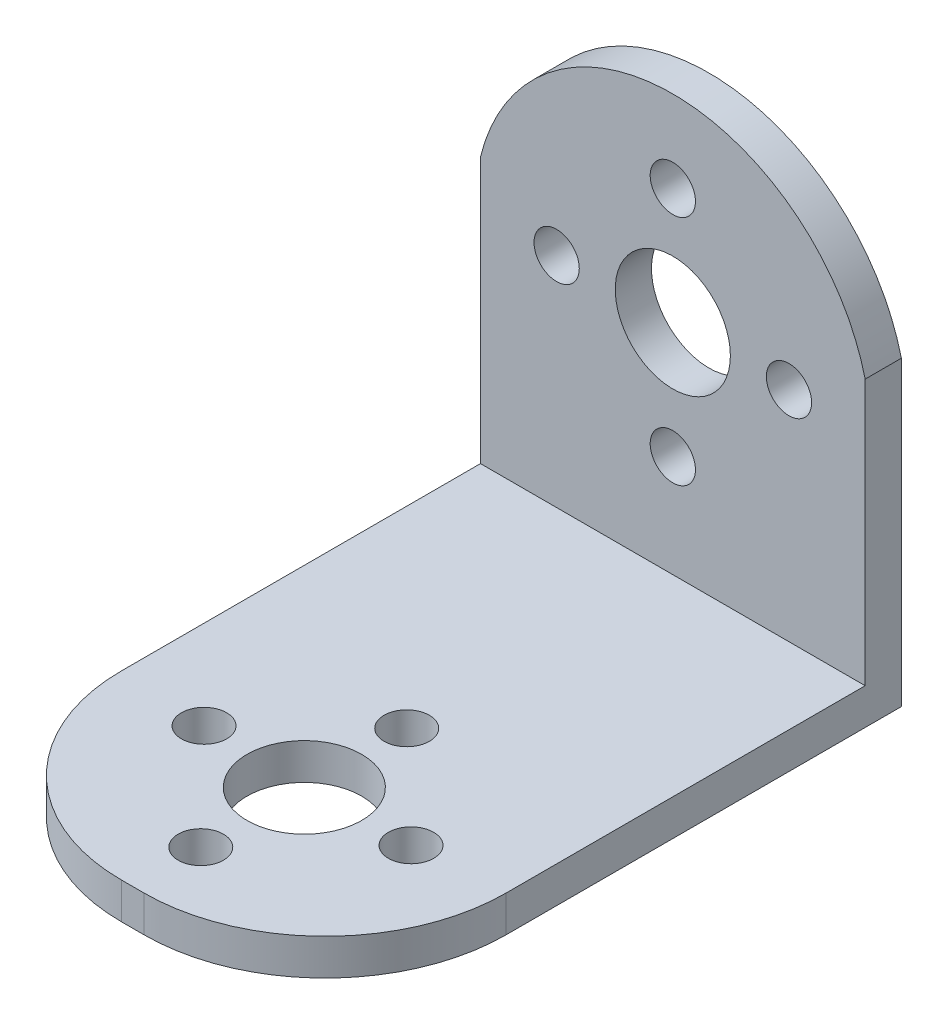
from build123d import *

# Parameters (mm, degrees)
SKETCH1_R           = 1.5
SKETCH1_R_2         = 3.815
BOSS_EXTRUDE1_DEPTH = 2.4
SKETCH2_W           = 25.5
SKETCH2_H           = 2.4
BOSS_EXTRUDE2_DEPTH = 35.8
CUT_EXTRUDE1_DEPTH  = 35.8
SKETCH4_R           = 3.8
SKETCH4_R_2         = 1.500976088
SKETCH4_R_3         = 1.5
CUT_EXTRUDE2_DEPTH  = 35.8


with BuildPart() as part:
    # Sketch1 → Boss-Extrude1 (new body)
    with BuildSketch(Plane.XY):
        with BuildLine():
            Line((0, 0), (25.5, 0))
            Line((25.5, 0), (25.5, 20))
            ThreePointArc((25.5, 20), (12.75, 30), (0, 20))
            Line((0, 20), (0, 0))
        make_face()
        with Locations((12.75, 24.571875)):
            Circle(SKETCH1_R, mode=Mode.SUBTRACT)
        with Locations((12.75, 16.871875)):
            Circle(SKETCH1_R_2, mode=Mode.SUBTRACT)
        with Locations((20.45, 16.871875)):
            Circle(SKETCH1_R, mode=Mode.SUBTRACT)
        with Locations((12.75, 9.171875)):
            Circle(SKETCH1_R, mode=Mode.SUBTRACT)
        with Locations((5.05, 16.871875)):
            Circle(SKETCH1_R, mode=Mode.SUBTRACT)
    extrude(amount=BOSS_EXTRUDE1_DEPTH)

    # Sketch2 → Boss-Extrude2 (add)
    with BuildSketch(Plane.XY.offset(2.4)):
        with Locations((12.75, 1.2)):
            Rectangle(SKETCH2_W, SKETCH2_H)
    extrude(amount=BOSS_EXTRUDE2_DEPTH)

    # Sketch3 → Cut-Extrude1 (cut)
    with BuildSketch(Plane.XZ):
        with BuildLine():
            ThreePointArc((0, 26.2), (3.514718626, 34.685281374), (12, 38.2))
            Line((12, 38.2), (0, 38.2))
            Line((0, 38.2), (0, 26.2))
        make_face()
        with BuildLine():
            Line((25.5, 38.2), (13.5, 38.2))
            ThreePointArc((13.5, 38.2), (21.985281374, 34.685281374), (25.5, 26.2))
            Line((25.5, 26.2), (25.5, 38.2))
        make_face()
    extrude(amount=-CUT_EXTRUDE1_DEPTH, mode=Mode.SUBTRACT)

    # Sketch4 → Cut-Extrude2 (cut)
    with BuildSketch(Plane.XZ):
        with Locations(Location((12.75, 26.823800226, 0), (0, 0, 270))):
            Circle(SKETCH4_R)
        with Locations(Location((5.89, 26.612165956, 0), (0, 0, 270))):
            Circle(SKETCH4_R_2)
        with Locations(Location((19.61, 26.612165956, 0), (0, 0, 270))):
            Circle(SKETCH4_R_3)
        with Locations(Location((12.75, 33.687165956, 0), (0, 0, 270))):
            Circle(SKETCH4_R_3)
        with Locations(Location((12.75, 20.037167493, 0), (0, 0, 270))):
            Circle(SKETCH4_R_3)
    extrude(amount=-CUT_EXTRUDE2_DEPTH, mode=Mode.SUBTRACT)


solid = part.part
